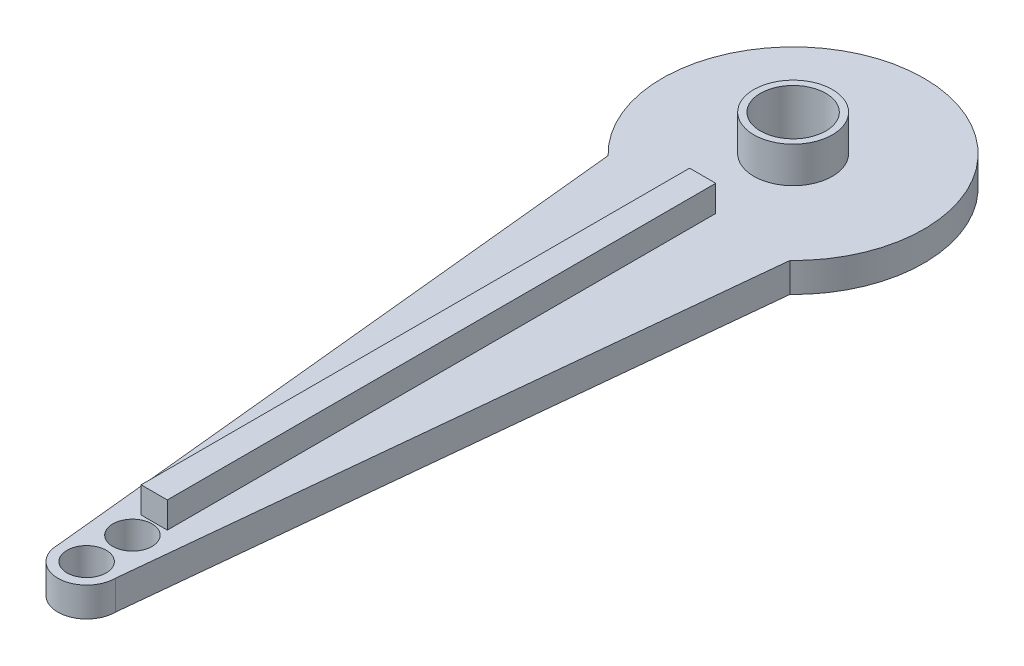
from build123d import *

# Parameters (mm, degrees)
SKETCH1_R           = 3
SKETCH1_R_2         = 1.5
BOSS_EXTRUDE1_DEPTH = 2.25
SKETCH2_R           = 3.879501895
BOSS_EXTRUDE2_DEPTH = 2.25
SKETCH3_R           = 3
SKETCH3_R_2         = 2.008527967
BOSS_EXTRUDE3_DEPTH = 1
SKETCH4_R           = 3.8
SKETCH4_R_2         = 3
CUT_EXTRUDE1_DEPTH  = 0.5
SKETCH5_W           = 2
SKETCH5_H           = 45.085962507
BOSS_EXTRUDE4_DEPTH = 2
CUT_EXTRUDE2_START  = -2.25
SKETCH7_R           = 3.879501895
CUT_EXTRUDE2_DEPTH  = 2.25
SKETCH8_R           = 3
SKETCH8_R_2         = 2.5
BOSS_EXTRUDE5_DEPTH = 4
SKETCH9_W           = 2
SKETCH9_H           = 3.166270057
CUT_EXTRUDE3_DEPTH  = 2


with BuildPart() as part:
    # Sketch1 → Boss-Extrude1 (new body)
    with BuildSketch(Plane(origin=(0, 0, 0), x_dir=(1, 0, 0), z_dir=(0, 1, 0))):
        with BuildLine():
            Line((2.2, -54), (6.944444444, -7.195463248))
            ThreePointArc((6.944444444, -7.195463248), (0, 10), (-6.944444444, -7.195463248))
            Line((-6.944444444, -7.195463248), (-2.2, -54))
            ThreePointArc((-2.2, -54), (0, -56.2), (2.2, -54))
        make_face()
        with Locations(Location((0, 0, 0), (0, 0, 270))):
            Circle(SKETCH1_R, mode=Mode.SUBTRACT)
        with Locations(Location((0, -54, 0), (0, 0, 270))):
            Circle(SKETCH1_R_2, mode=Mode.SUBTRACT)
        with Locations(Location((0, -50.5, 0), (0, 0, 270))):
            Circle(SKETCH1_R_2, mode=Mode.SUBTRACT)
    extrude(amount=BOSS_EXTRUDE1_DEPTH)

    # Sketch2 → Boss-Extrude2 (add)
    with BuildSketch(Plane(origin=(0, 2.25, 0), x_dir=(1, 0, 0), z_dir=(0, 1, 0))):
        with Locations(Location((0, 0, 0), (0, 0, 270))):
            Circle(SKETCH2_R)
        with BuildLine():
            Line((1.96, 0), (2.349274052, 0.224747479))
            ThreePointArc((2.349274052, 0.224747479), (2.341390695, 0.295786431), (2.331359713, 0.366554076))
            Line((2.331359713, 0.366554076), (1.898422996, 0.487432179))
            Line((1.898422996, 0.487432179), (2.219574862, 0.801927322))
            ThreePointArc((2.219574862, 0.801927322), (2.194272507, 0.868773944), (2.166957468, 0.934823689))
            Line((2.166957468, 0.934823689), (1.717561093, 0.944237201))
            Line((1.717561093, 0.944237201), (1.950411621, 1.328719123))
            ThreePointArc((1.950411621, 1.328719123), (1.909280107, 1.387173195), (1.866397317, 1.444354892))
            Line((1.866397317, 1.444354892), (1.42877851, 1.341712328))
            Line((1.42877851, 1.341712328), (1.558696845, 1.772022614))
            ThreePointArc((1.558696845, 1.772022614), (1.504320616, 1.818411253), (1.448564558, 1.863131966))
            Line((1.448564558, 1.863131966), (1.050220518, 1.654882734))
            Line((1.050220518, 1.654882734), (1.069043413, 2.103983408))
            ThreePointArc((1.069043413, 2.103983408), (1.004839128, 2.135391844), (0.939713161, 2.164841605))
            Line((0.939713161, 2.164841605), (0.605673309, 1.864070772))
            Line((0.605673309, 1.864070772), (0.512218052, 2.303743186))
            ThreePointArc((0.512218052, 2.303743186), (0.442219902, 2.318197912), (0.371816129, 2.330526285))
            Line((0.371816129, 2.330526285), (0.123069418, 1.956132388))
            Line((0.123069418, 1.956132388), (-0.076791853, 2.358750307))
            ThreePointArc((-0.076791853, 2.358750307), (-0.148185626, 2.355343079), (-0.219443477, 2.349775428))
            Line((-0.219443477, 2.349775428), (-0.367267377, 1.925283011))
            Line((-0.367267377, 1.925283011), (-0.660976643, 2.265548472))
            ThreePointArc((-0.660976643, 2.265548472), (-0.729280107, 2.244493378), (-0.796914643, 2.221379538))
            Line((-0.796914643, 2.221379538), (-0.834527411, 1.773461023))
            Line((-0.834527411, 1.773461023), (-1.20362984, 2.029993894))
            ThreePointArc((-1.20362984, 2.029993894), (-1.264551236, 1.992613904), (-1.324312731, 1.953406202))
            Line((-1.324312731, 1.953406202), (-1.24935102, 1.510205956))
            Line((-1.24935102, 1.510205956), (-1.670654548, 1.666887333))
            ThreePointArc((-1.670654548, 1.666887333), (-1.720365961, 1.61553117), (-1.768499379, 1.562693171))
            Line((-1.768499379, 1.562693171), (-1.585673309, 1.152059094))
            Line((-1.585673309, 1.152059094), (-2.032705886, 1.199044112))
            ThreePointArc((-2.032705886, 1.199044112), (-2.068083765, 1.136938671), (-2.101564707, 1.07379038))
            Line((-2.101564707, 1.07379038), (-1.822361912, 0.721524123))
            Line((-1.822361912, 0.721524123), (-2.267034837, 0.655860539))
            ThreePointArc((-2.267034837, 0.655860539), (-2.28585626, 0.586908134), (-2.302580996, 0.517417391))
            Line((-2.302580996, 0.517417391), (-1.944544815, 0.245653138))
            Line((-1.944544815, 0.245653138), (-2.358917653, 0.071466836))
            ThreePointArc((-2.358917653, 0.071466836), (-2.36, 0), (-2.358917653, -0.071466836))
            Line((-2.358917653, -0.071466836), (-1.944544815, -0.245653138))
            Line((-1.944544815, -0.245653138), (-2.302580996, -0.517417391))
            ThreePointArc((-2.302580996, -0.517417391), (-2.28585626, -0.586908134), (-2.267034837, -0.655860539))
            Line((-2.267034837, -0.655860539), (-1.822361912, -0.721524123))
            Line((-1.822361912, -0.721524123), (-2.101564707, -1.07379038))
            ThreePointArc((-2.101564707, -1.07379038), (-2.068083765, -1.136938671), (-2.032705886, -1.199044112))
            Line((-2.032705886, -1.199044112), (-1.585673309, -1.152059094))
            Line((-1.585673309, -1.152059094), (-1.768499379, -1.562693171))
            ThreePointArc((-1.768499379, -1.562693171), (-1.720365961, -1.61553117), (-1.670654548, -1.666887333))
            Line((-1.670654548, -1.666887333), (-1.24935102, -1.510205956))
            Line((-1.24935102, -1.510205956), (-1.324312731, -1.953406202))
            ThreePointArc((-1.324312731, -1.953406202), (-1.264551236, -1.992613904), (-1.20362984, -2.029993894))
            Line((-1.20362984, -2.029993894), (-0.834527411, -1.773461023))
            Line((-0.834527411, -1.773461023), (-0.796914643, -2.221379538))
            ThreePointArc((-0.796914643, -2.221379538), (-0.729280107, -2.244493378), (-0.660976643, -2.265548472))
            Line((-0.660976643, -2.265548472), (-0.367267377, -1.925283011))
            Line((-0.367267377, -1.925283011), (-0.219443477, -2.349775428))
            ThreePointArc((-0.219443477, -2.349775428), (-0.148185626, -2.355343079), (-0.076791853, -2.358750307))
            Line((-0.076791853, -2.358750307), (0.123069418, -1.956132388))
            Line((0.123069418, -1.956132388), (0.371816129, -2.330526285))
            ThreePointArc((0.371816129, -2.330526285), (0.442219902, -2.318197912), (0.512218052, -2.303743186))
            Line((0.512218052, -2.303743186), (0.605673309, -1.864070772))
            Line((0.605673309, -1.864070772), (0.939713161, -2.164841605))
            ThreePointArc((0.939713161, -2.164841605), (1.004839128, -2.135391844), (1.069043413, -2.103983408))
            Line((1.069043413, -2.103983408), (1.050220518, -1.654882734))
            Line((1.050220518, -1.654882734), (1.448564558, -1.863131966))
            ThreePointArc((1.448564558, -1.863131966), (1.504320616, -1.818411253), (1.558696845, -1.772022614))
            Line((1.558696845, -1.772022614), (1.42877851, -1.341712328))
            Line((1.42877851, -1.341712328), (1.866397317, -1.444354892))
            ThreePointArc((1.866397317, -1.444354892), (1.909280107, -1.387173195), (1.950411621, -1.328719123))
            Line((1.950411621, -1.328719123), (1.717561093, -0.944237201))
            Line((1.717561093, -0.944237201), (2.166957468, -0.934823689))
            ThreePointArc((2.166957468, -0.934823689), (2.194272507, -0.868773944), (2.219574862, -0.801927322))
            Line((2.219574862, -0.801927322), (1.898422996, -0.487432179))
            Line((1.898422996, -0.487432179), (2.331359713, -0.366554076))
            ThreePointArc((2.331359713, -0.366554076), (2.341390695, -0.295786431), (2.349274052, -0.224747479))
            Line((2.349274052, -0.224747479), (1.96, 0))
        make_face(mode=Mode.SUBTRACT)
    extrude(amount=BOSS_EXTRUDE2_DEPTH)

    # Sketch3 → Boss-Extrude3 (add)
    with BuildSketch(Plane.XZ):
        with Locations(Location((0, 0, 0), (0, 0, 270))):
            Circle(SKETCH3_R)
        with Locations(Location((0, 0, 0), (0, 0, 270))):
            Circle(SKETCH3_R_2, mode=Mode.SUBTRACT)
    extrude(amount=-BOSS_EXTRUDE3_DEPTH)

    # Sketch4 → Cut-Extrude1 (cut)
    with BuildSketch(Plane.XZ):
        with Locations(Location((0, 0, 0), (0, 0, 270))):
            Circle(SKETCH4_R)
        with Locations(Location((0, 0, 0), (0, 0, 270))):
            Circle(SKETCH4_R_2, mode=Mode.SUBTRACT)
    extrude(amount=-CUT_EXTRUDE1_DEPTH, mode=Mode.SUBTRACT)

    # Sketch5 → Boss-Extrude4 (add)
    with BuildSketch(Plane(origin=(0, 2.25, 0), x_dir=(1, 0, 0), z_dir=(0, 1, 0))):
        with Locations((0, -26.291385575)):
            Rectangle(SKETCH5_W, SKETCH5_H)
    extrude(amount=BOSS_EXTRUDE4_DEPTH)

    # Sketch7 → Cut-Extrude2 (cut)
    with BuildSketch(Plane(origin=(0, 4.5, 0), x_dir=(1, 0, 0), z_dir=(0, 1, 0)).offset(CUT_EXTRUDE2_START)):
        Circle(SKETCH7_R)
    extrude(amount=CUT_EXTRUDE2_DEPTH, mode=Mode.SUBTRACT)

    # Sketch8 → Boss-Extrude5 (add)
    with BuildSketch(Plane(origin=(0, 1, 0), x_dir=(1, 0, 0), z_dir=(0, 1, 0))):
        with Locations(Location((0, 0, 0), (0, 0, 90))):
            Circle(SKETCH8_R)
        with Locations(Location((0, 0, 0), (0, 0, 270))):
            Circle(SKETCH8_R_2, mode=Mode.SUBTRACT)
    extrude(amount=BOSS_EXTRUDE5_DEPTH)

    # Sketch9 → Cut-Extrude3 (cut)
    with BuildSketch(Plane(origin=(0, 4.25, 0), x_dir=(1, 0, 0), z_dir=(0, 1, 0))):
        with Locations((0, -5.33153935)):
            Rectangle(SKETCH9_W, SKETCH9_H)
    extrude(amount=-CUT_EXTRUDE3_DEPTH, mode=Mode.SUBTRACT)


solid = part.part
